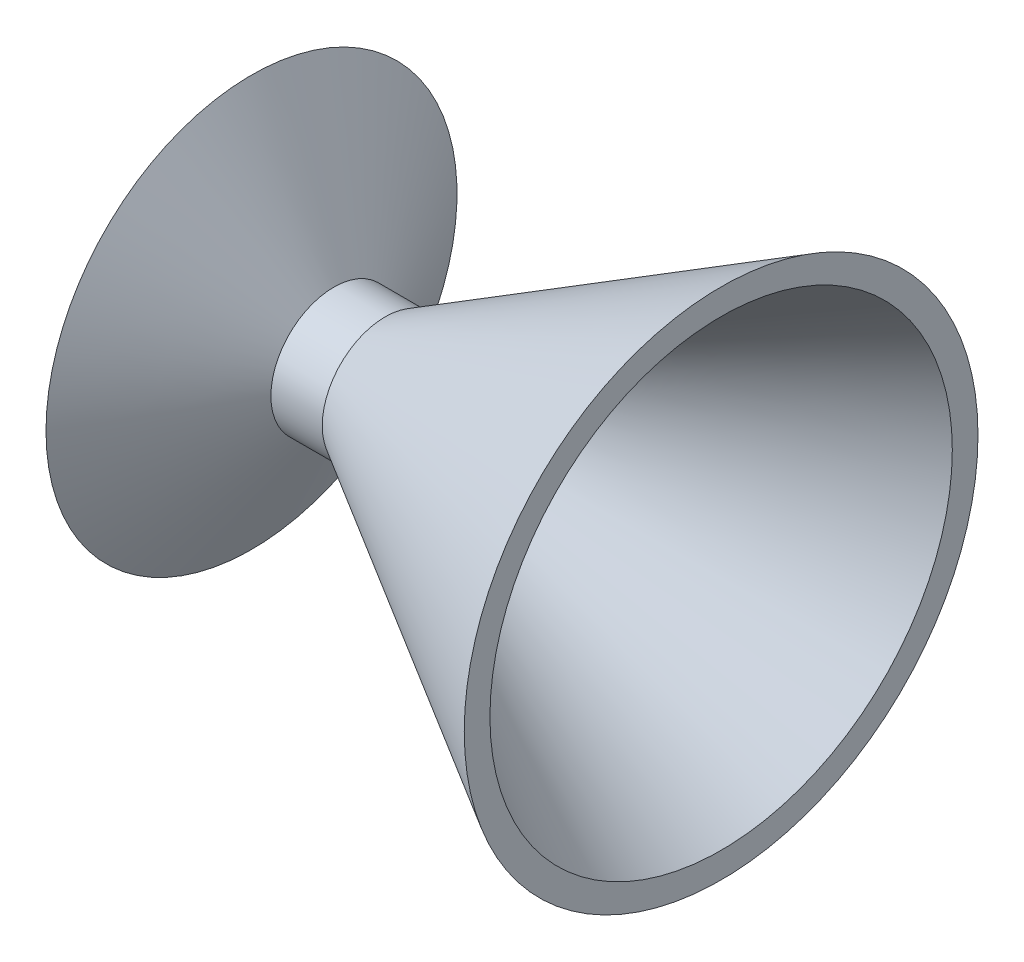
from build123d import *


with BuildPart() as part:
    # Sketch1 → Revolve1 (revolve)
    with BuildSketch(Plane.XY, mode=Mode.PRIVATE) as revolve1_sk:
        Polygon((0, 15.5575), (83.038845842, 63.5), (83.038845842, 57.15), (0, 7.9375), (-12.7, 7.9375), (-33.047266862, 41.275), (-33.047266862, 50.8), (-12.7, 15.5575), align=None)
    revolve(revolve1_sk.sketch.rotate(Axis((0, 0, 0), (1, 0, 0)), 90), axis=Axis((0, 0, 0), (1, 0, 0)))


solid = part.part
